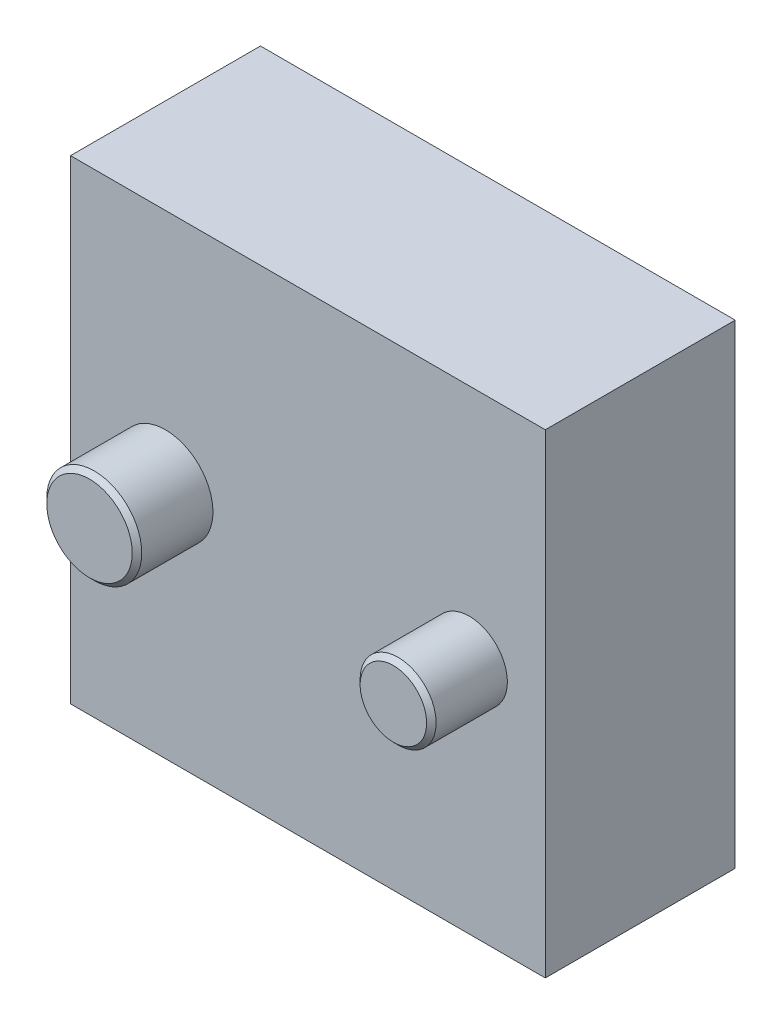
from build123d import *

# Parameters (mm, degrees)
SKETCH_3_W      = 50
SKETCH_3_H      = 50
EXTRUDE_3_DEPTH = 20
SKETCH_4_R      = 5
SKETCH_4_R_2    = 4
EXTRUDE_4_DEPTH = 8
CHAMFER_2_SIZE  = 0.5
CHAMFER_3_SIZE  = 0.5


with BuildPart() as part:
    # 草图3 → 凸台-拉伸3 (new body)
    with BuildSketch(Plane.XY):
        Rectangle(SKETCH_3_W, SKETCH_3_H)
    extrude(amount=EXTRUDE_3_DEPTH)

    # 草图4 → 凸台-拉伸4 (add)
    with BuildSketch(Plane.XY.offset(20)):
        with Locations(Location((-15, 0, 0), (0, 0, 180))):
            Circle(SKETCH_4_R)
        with Locations(Location((17, 0, 0), (0, 0, 180))):
            Circle(SKETCH_4_R_2)
    extrude(amount=EXTRUDE_4_DEPTH)

    # 倒角2
    chamfer_2_edges = [part.edges().sort_by_distance(p)[0] for p in [
        (-10, 0, 28),
    ]]
    chamfer(chamfer_2_edges, length=CHAMFER_2_SIZE)

    # 倒角3
    chamfer_3_edges = [part.edges().sort_by_distance(p)[0] for p in [
        (21, 0, 28),
    ]]
    chamfer(chamfer_3_edges, length=CHAMFER_3_SIZE)


solid = part.part
